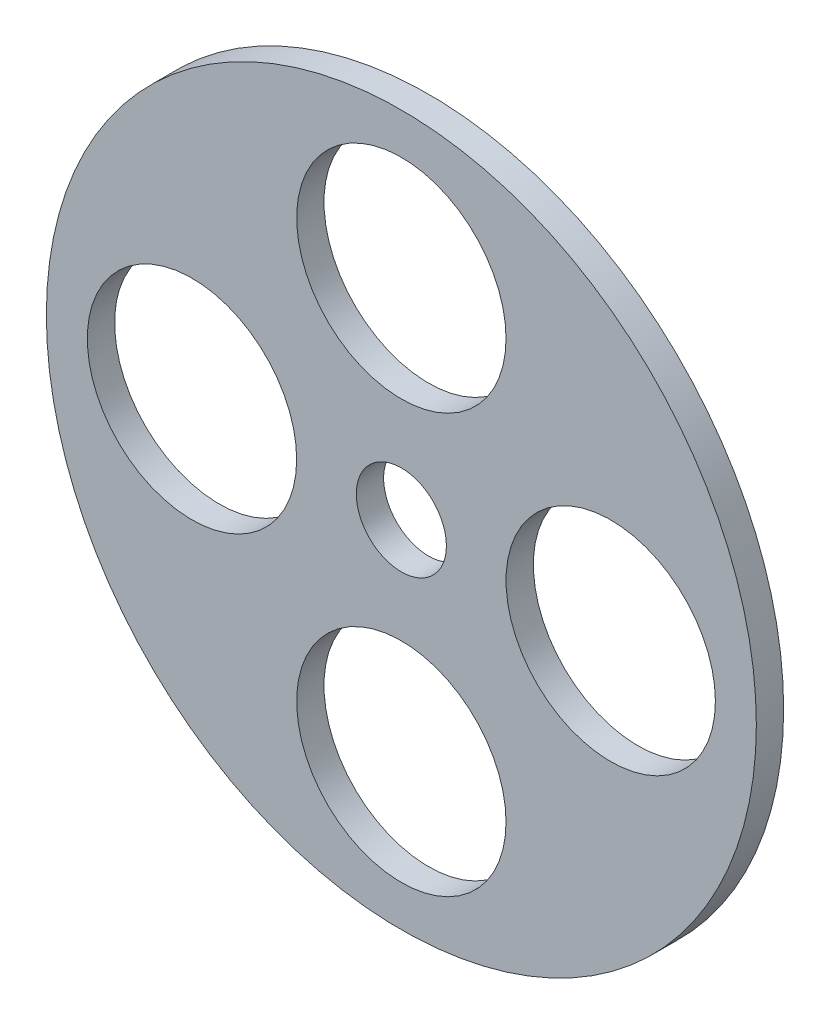
from build123d import *

# Parameters (mm, degrees)
ESQUISSE1_R        = 39
ESQUISSE1_R_2      = 4.95
ESQUISSE1_R_3      = 11.5
BOSS_EXTRU_1_DEPTH = 3


with BuildPart() as part:
    # Esquisse1 → Boss.-Extru.1 (new body)
    with BuildSketch(Plane.XY):
        Circle(ESQUISSE1_R)
        Circle(ESQUISSE1_R_2, mode=Mode.SUBTRACT)
        with Locations((0, 23)):
            Circle(ESQUISSE1_R_3, mode=Mode.SUBTRACT)
        with Locations((23, 0)):
            Circle(ESQUISSE1_R_3, mode=Mode.SUBTRACT)
        with Locations((0, -23)):
            Circle(ESQUISSE1_R_3, mode=Mode.SUBTRACT)
        with Locations((-23, 0)):
            Circle(ESQUISSE1_R_3, mode=Mode.SUBTRACT)
    extrude(amount=BOSS_EXTRU_1_DEPTH)


solid = part.part
